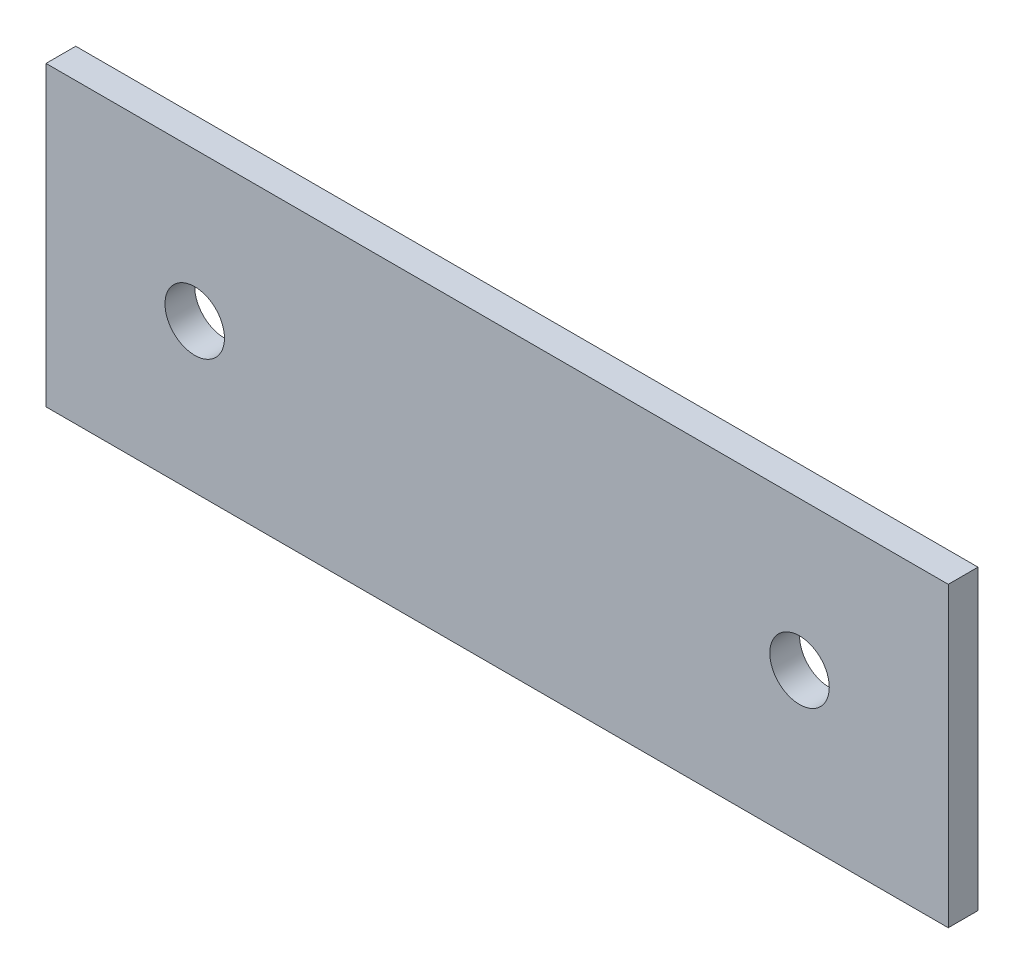
from build123d import *

# Parameters (mm, degrees)
ESQUISSE1_W      = 45.5
ESQUISSE1_H      = 15
ESQUISSE1_R      = 1.5
EXTRUSION1_DEPTH = 1.5


with BuildPart() as part:
    # Esquisse1 → Extrusion1 (new body)
    with BuildSketch(Plane.XY):
        with Locations((-13.317265327, 7.499368421)):
            Rectangle(ESQUISSE1_W, ESQUISSE1_H)
        with Locations((-28.567265327, 7.499368421)):
            Circle(ESQUISSE1_R, mode=Mode.SUBTRACT)
        with Locations((1.932734673, 7.499368421)):
            Circle(ESQUISSE1_R, mode=Mode.SUBTRACT)
    extrude(amount=EXTRUSION1_DEPTH)


solid = part.part
